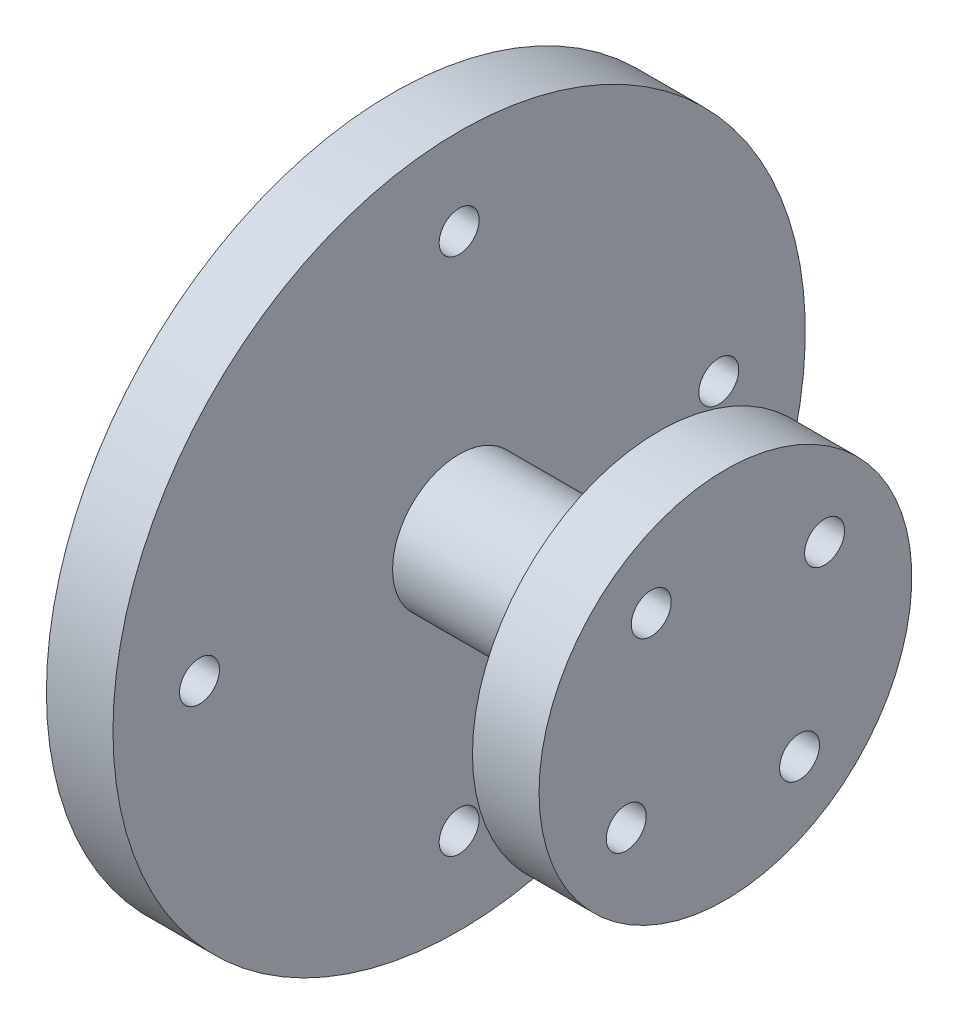
from build123d import *

# Parameters (mm, degrees)
SKETCH_2_R               = 1.5
CUT_EXTRUDE_1_DEPTH      = 45.463468151
PATTERN_CIRCULAR_1_COUNT = 4
CUT_EXTRUDE_2_REACH      = 46.463
SKETCH_3_R               = 1.5
PATTERN_CIRCULAR_2_COUNT = 4


with BuildPart() as part:
    # Эскиз1 → Повернуть1 (revolve)
    with BuildSketch(Plane.XY):
        Polygon((0, 0), (0, 26), (5, 26), (5, 5), (20, 5), (20, 14), (25, 14), (25, 0), align=None)
    revolve(axis=Axis((0, 0, 0), (1, 0, 0)))

    # Эскиз2 → Вырез-Вытянуть1 (cut, through all)
    with BuildSketch(Plane.ZY):
        with Locations((0, 19.5)):
            Circle(SKETCH_2_R)
    cut_extrude_1 = extrude(amount=-CUT_EXTRUDE_1_DEPTH, mode=Mode.SUBTRACT)

    # Круговой массив1: Вырез-Вытянуть1 ×4 about axis
    pattern_circular_1_axis = Axis((5, 0, 0), (-1, 0, 0))
    for i in range(1, PATTERN_CIRCULAR_1_COUNT):
        add(cut_extrude_1.rotate(pattern_circular_1_axis, i * 360 / PATTERN_CIRCULAR_1_COUNT), mode=Mode.SUBTRACT)

    # Эскиз3 → Вырез-Вытянуть2 (cut, up to next)
    with BuildSketch(Plane(origin=(25, 0, 0), x_dir=(0, 0, -1), z_dir=(1, 0, 0)), mode=Mode.PRIVATE) as cut_extrude_2_sk1:
        with Locations((7.448193574, 5.569058492)):
            Circle(SKETCH_3_R)
    cut_extrude_2_tool1 = extrude(cut_extrude_2_sk1.sketch, amount=-CUT_EXTRUDE_2_REACH, mode=Mode.PRIVATE) & part.part
    cut_extrude_2 = cut_extrude_2_tool1.solids().sort_by_distance((25, 5.569058, -7.448194))[0]
    add(cut_extrude_2, mode=Mode.SUBTRACT)

    # Круговой массив2: Вырез-Вытянуть2 ×4 about axis
    pattern_circular_2_axis = Axis((5, 0, 0), (-1, 0, 0))
    for i in range(1, PATTERN_CIRCULAR_2_COUNT):
        add(cut_extrude_2.rotate(pattern_circular_2_axis, i * 360 / PATTERN_CIRCULAR_2_COUNT), mode=Mode.SUBTRACT)


solid = part.part
